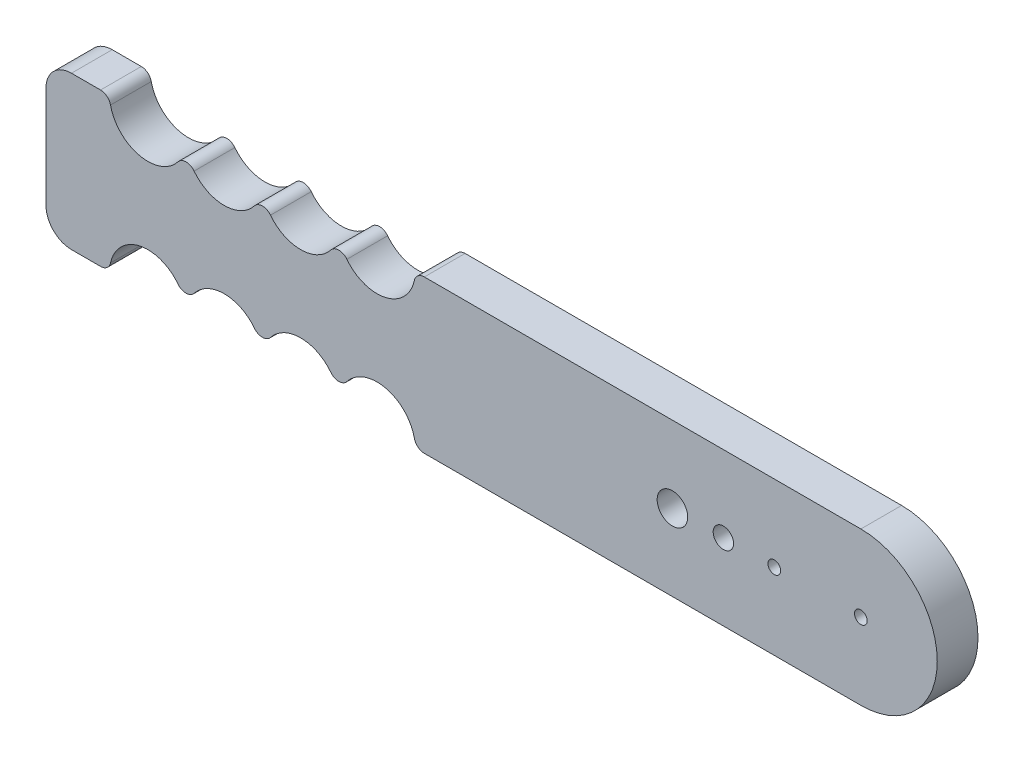
from build123d import *

# Parameters (mm, degrees)
SKETCH1_R           = 1.25
SKETCH1_R_2         = 3
SKETCH1_R_3         = 2
BOSS_EXTRUDE1_DEPTH = 8
FILLET1_R           = 5
FILLET2_R           = 2


with BuildPart() as part:
    # Sketch1 → Boss-Extrude1 (new body)
    with BuildSketch(Plane.XY):
        with BuildLine():
            Line((0, 15), (-87.5, 15))
            ThreePointArc((-87.5, 15), (-95, 7.5), (-102.5, 15))
            ThreePointArc((-102.5, 15), (-110, 7.5), (-117.5, 15))
            ThreePointArc((-117.5, 15), (-125, 7.5), (-132.5, 15))
            ThreePointArc((-132.5, 15), (-140, 7.5), (-147.5, 15))
            Line((-147.5, 15), (-160, 15))
            Line((-160, 15), (-160, -15))
            Line((-160, -15), (-147.5, -15))
            ThreePointArc((-147.5, -15), (-140, -7.5), (-132.5, -15))
            ThreePointArc((-132.5, -15), (-125, -7.5), (-117.5, -15))
            ThreePointArc((-117.5, -15), (-110, -7.5), (-102.5, -15))
            ThreePointArc((-102.5, -15), (-95, -7.5), (-87.5, -15))
            Line((-87.5, -15), (0, -15))
            ThreePointArc((0, -15), (15, 0), (0, 15))
        make_face()
        Circle(SKETCH1_R, mode=Mode.SUBTRACT)
        with Locations((-17, 0)):
            Circle(SKETCH1_R, mode=Mode.SUBTRACT)
        with Locations((-37, 0)):
            Circle(SKETCH1_R_2, mode=Mode.SUBTRACT)
        with Locations((-27, 0)):
            Circle(SKETCH1_R_3, mode=Mode.SUBTRACT)
    extrude(amount=BOSS_EXTRUDE1_DEPTH)

    # Fillet1
    fillet1_edges = [part.edges().sort_by_distance(p)[0] for p in [
        (-160, -15, 4),
        (-160, 15, 4),
    ]]
    fillet(fillet1_edges, radius=FILLET1_R)

    # Fillet2
    fillet2_edges = [part.edges().sort_by_distance(p)[0] for p in [
        (-87.5, -15, 4),
        (-102.5, -15, 4),
        (-117.5, -15, 4),
        (-132.5, -15, 4),
        (-147.5, -15, 4),
        (-147.5, 15, 4),
        (-132.5, 15, 4),
        (-117.5, 15, 4),
        (-102.5, 15, 4),
        (-87.5, 15, 4),
    ]]
    fillet(fillet2_edges, radius=FILLET2_R)


solid = part.part
